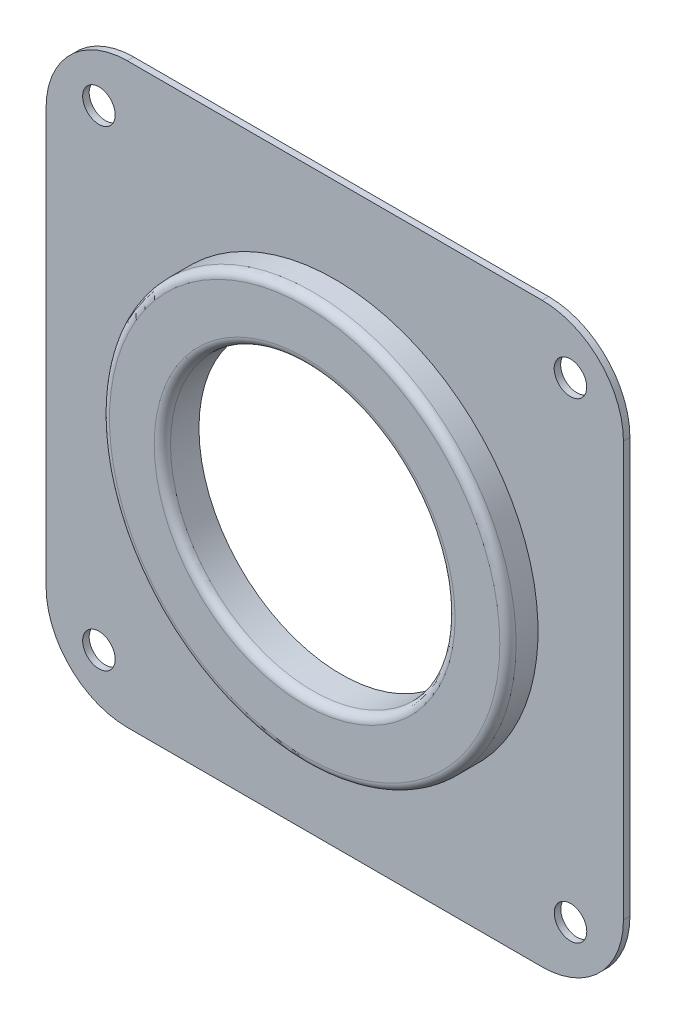
from build123d import *

# Parameters (mm, degrees)
SKETCH_1_W            = 71
SKETCH_1_H            = 71
EXTRUDE_1_DEPTH       = 0.8
SKETCH_2_W            = 25
SKETCH_2_H            = 3.7
HOLE_WIZARD_M30_1_D   = 35
HOLE_WIZARD_4_0_4_1_D = 4
FILLET_1_R            = 1
FILLET_2_R            = 10


with BuildPart() as part:
    # 草图1 → 凸台-拉伸1 (new body)
    with BuildSketch(Plane.XY.offset(1)):
        Rectangle(SKETCH_1_W, SKETCH_1_H)
    extrude(amount=-EXTRUDE_1_DEPTH)

    # 草图2 → 旋转1 (revolve)
    with BuildSketch(Plane.XZ, mode=Mode.PRIVATE) as revolve_1_sk:
        with Locations((12.5, 2.85)):
            Rectangle(SKETCH_2_W, SKETCH_2_H)
    revolve(revolve_1_sk.sketch.rotate(Axis((0, 0, 4.7), (0, 0, -1)), 180), axis=Axis((0, 0, 4.7), (0, 0, -1)))

    # M30 间隙孔1 (through all)
    with Locations(Plane.XY.offset(4.7)):
        with Locations((0, 0)):
            Hole(HOLE_WIZARD_M30_1_D / 2)

    # Ø4.0 (4) 直径孔1 (through all)
    with Locations(Plane.XY.offset(1)):
        with Locations((-29, 28.98), (-29, -29), (28.992753946, -28.992756445), (28.982756057, 28.982756057)):
            Hole(HOLE_WIZARD_4_0_4_1_D / 2)

    # 圆角1
    fillet_1_edges = [part.edges().sort_by_distance(p)[0] for p in [
        (25, 0, 4.7),
        (17.5, 0, 4.7),
    ]]
    fillet(fillet_1_edges, radius=FILLET_1_R)

    # 圆角2
    fillet_2_edges = [part.edges().sort_by_distance(p)[0] for p in [
        (35.5, 35.5, 0.6),
        (35.5, -35.5, 0.6),
        (-35.5, -35.5, 0.6),
        (-35.5, 35.5, 0.6),
    ]]
    fillet(fillet_2_edges, radius=FILLET_2_R)


solid = part.part
